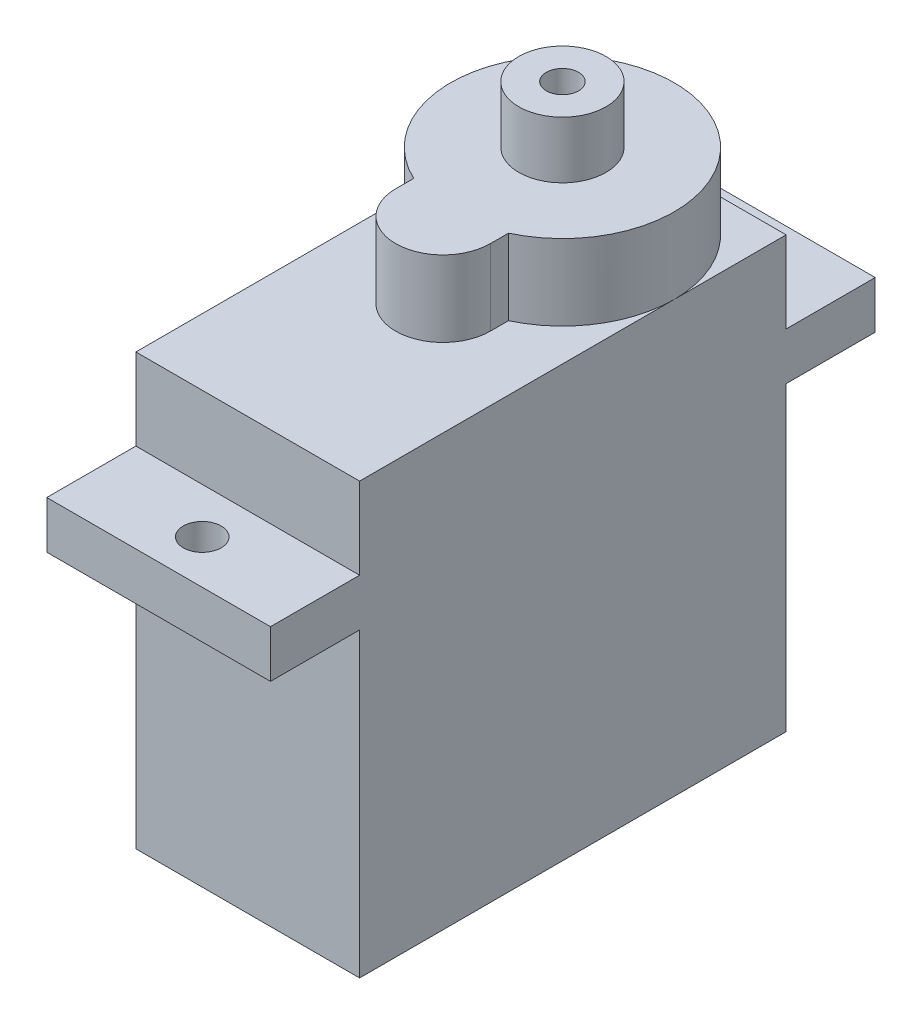
from build123d import *

# Parameters (mm, degrees)
SKETCH1_W           = 11.8
SKETCH1_H           = 22.7
BOSS_EXTRUDE1_DEPTH = 22.5
BOSS_EXTRUDE2_DEPTH = 4
SKETCH3_R           = 2.3
SKETCH3_R_2         = 0.85
BOSS_EXTRUDE3_DEPTH = 3
SKETCH4_W           = 4.7
SKETCH4_H           = 2.5
BOSS_EXTRUDE4_DEPTH = 11.8
CUT_EXTRUDE1_REACH  = 35.365
SKETCH5_R           = 1


with BuildPart() as part:
    # Sketch1 → Boss-Extrude1 (new body)
    with BuildSketch(Plane.XY):
        Rectangle(SKETCH1_W, SKETCH1_H)
    extrude(amount=BOSS_EXTRUDE1_DEPTH)

    # Sketch2 → Boss-Extrude2 (add)
    with BuildSketch(Plane(origin=(0, 11.35, 0), x_dir=(1, 0, 0), z_dir=(0, 1, 0))):
        with BuildLine():
            Line((2.5, -12.2), (2.5, -11.244155686))
            ThreePointArc((2.5, -11.244155686), (0, 0), (-2.5, -11.244155686))
            Line((-2.5, -11.244155686), (-2.5, -12.2))
            ThreePointArc((-2.5, -12.2), (0, -14.7), (2.5, -12.2))
        make_face()
    extrude(amount=BOSS_EXTRUDE2_DEPTH)

    # Sketch3 → Boss-Extrude3 (add)
    with BuildSketch(Plane(origin=(0, 15.35, 0), x_dir=(1, 0, 0), z_dir=(0, 1, 0))):
        with Locations(Location((0, -5.9, 0), (0, 0, 270))):
            Circle(SKETCH3_R)
        with Locations(Location((0, -5.9, 0), (0, 0, 270))):
            Circle(SKETCH3_R_2, mode=Mode.SUBTRACT)
    extrude(amount=BOSS_EXTRUDE3_DEPTH)

    # Sketch4 → Boss-Extrude4 (add)
    with BuildSketch(Plane.ZY.offset(5.9)):
        with Locations((-2.35, 5.8)):
            Rectangle(SKETCH4_W, SKETCH4_H)
        with Locations((24.85, 5.8)):
            Rectangle(SKETCH4_W, SKETCH4_H)
    extrude(amount=-BOSS_EXTRUDE4_DEPTH)

    # Sketch5 → Cut-Extrude1 (cut, up to next)
    with BuildSketch(Plane(origin=(0, 7.05, 0), x_dir=(1, 0, 0), z_dir=(0, 1, 0)), mode=Mode.PRIVATE) as cut_extrude1_sk1:
        with Locations(Location((0, 2.4, 0), (0, 0, 180))):
            Circle(SKETCH5_R)
    cut_extrude1_tool1 = extrude(cut_extrude1_sk1.sketch, amount=-CUT_EXTRUDE1_REACH, mode=Mode.PRIVATE) & part.part
    # Sketch5 → Cut-Extrude1 (cut, up to next)
    with BuildSketch(Plane(origin=(0, 7.05, 0), x_dir=(1, 0, 0), z_dir=(0, 1, 0)), mode=Mode.PRIVATE) as cut_extrude1_sk2:
        with Locations(Location((0, -24.9, 0), (0, 0, 180))):
            Circle(SKETCH5_R)
    cut_extrude1_tool2 = extrude(cut_extrude1_sk2.sketch, amount=-CUT_EXTRUDE1_REACH, mode=Mode.PRIVATE) & part.part
    add(cut_extrude1_tool1.solids().sort_by_distance((0, 7.05, -2.4))[0], mode=Mode.SUBTRACT)
    add(cut_extrude1_tool2.solids().sort_by_distance((0, 7.05, 24.9))[0], mode=Mode.SUBTRACT)


solid = part.part
